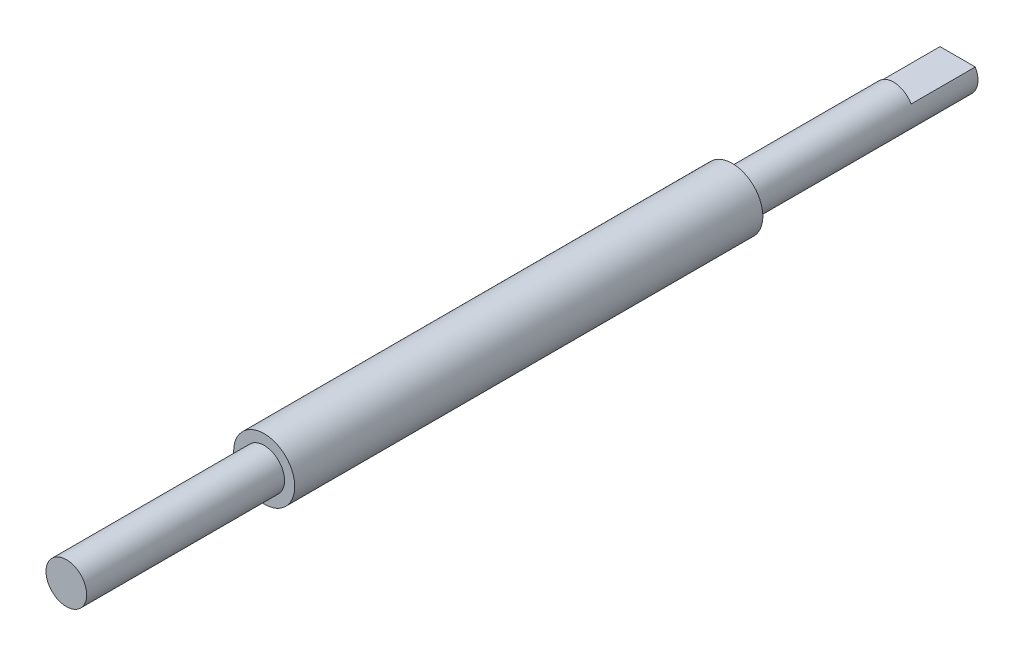
from build123d import *

# Parameters (mm, degrees)
SKETCH1_R           = 6.35
BOSS_EXTRUDE1_DEPTH = 278
BOSS_EXTRUDE2_START = -70.2975
SKETCH2_R           = 9.525
BOSS_EXTRUDE2_DEPTH = 146
CUT_EXTRUDE4_DEPTH  = 20


with BuildPart() as part:
    # Sketch1 → Boss-Extrude1 (new body)
    with BuildSketch(Plane.XY):
        Circle(SKETCH1_R)
    extrude(amount=BOSS_EXTRUDE1_DEPTH)

    # Sketch2 → Boss-Extrude2 (add)
    with BuildSketch(Plane(origin=(0, 0, 0), x_dir=(-1, 0, 0), z_dir=(0, 0, -1)).offset(BOSS_EXTRUDE2_START)):
        Circle(SKETCH2_R)
    extrude(amount=-BOSS_EXTRUDE2_DEPTH)

    # Sketch7 → Cut-Extrude4 (cut)
    with BuildSketch(Plane.XY):
        with BuildLine():
            Line((-5.499261314, 3.175), (5.499261314, 3.175))
            ThreePointArc((5.499261314, 3.175), (0, 6.35), (-5.499261314, 3.175))
        make_face()
    extrude(amount=CUT_EXTRUDE4_DEPTH, mode=Mode.SUBTRACT)


solid = part.part
